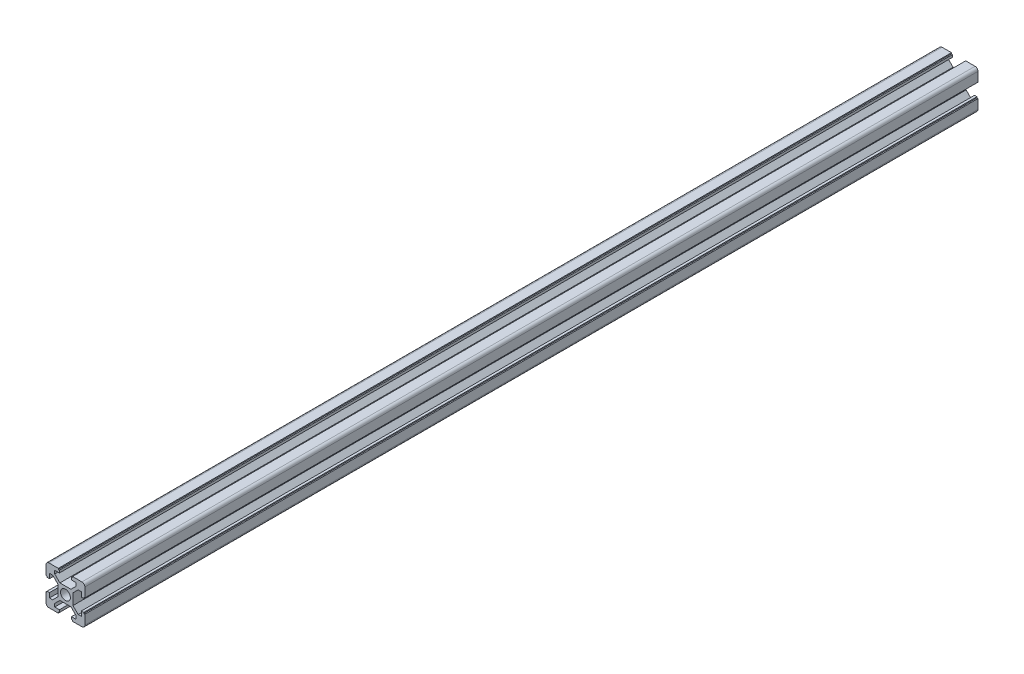
from build123d import *

# Parameters (mm, degrees)
BOSS_EXTRUDE1_DEPTH = 460
SKETCH3_R           = 2.55
CUT_EXTRUDE1_DEPTH  = 461.21733996
FILLET1_R           = 1.5


with BuildPart() as part:
    # Sketch2 → Boss-Extrude1 (new body)
    with BuildSketch(Plane.XY):
        Polygon((-10, 10), (-3.65, 10), (-3.65, 9.45), (-3.1, 9.45), (-3.1, 8.2), (-5.5, 8.2), (-5.5, 6.560660172), (-2.839339828, 3.9), (0, 3.9), (2.839339828, 3.9), (5.5, 6.560660172), (5.5, 8.2), (3.1, 8.2), (3.1, 9.45), (3.65, 9.45), (3.65, 10), (10, 10), (10, 3.65), (9.45, 3.65), (9.45, 3.1), (8.2, 3.1), (8.2, 5.5), (6.560660172, 5.5), (3.9, 2.839339828), (3.9, 0), (3.9, -2.839339828), (6.560660172, -5.5), (8.2, -5.5), (8.2, -3.1), (9.45, -3.1), (9.45, -3.65), (10, -3.65), (10, -10), (3.65, -10), (3.65, -9.45), (3.1, -9.45), (3.1, -8.2), (5.5, -8.2), (5.5, -6.560660172), (2.839339828, -3.9), (0, -3.9), (-2.839339828, -3.9), (-5.5, -6.560660172), (-5.5, -8.2), (-3.1, -8.2), (-3.1, -9.45), (-3.65, -9.45), (-3.65, -10), (-10, -10), (-10, -3.65), (-9.45, -3.65), (-9.45, -3.1), (-8.2, -3.1), (-8.2, -5.5), (-6.560660172, -5.5), (-3.9, -2.839339828), (-3.9, 0), (-3.9, 2.839339828), (-6.560660172, 5.5), (-8.2, 5.5), (-8.2, 3.1), (-9.45, 3.1), (-9.45, 3.65), (-10, 3.65), align=None)
    extrude(amount=-BOSS_EXTRUDE1_DEPTH)

    # Sketch3 → Cut-Extrude1 (cut, through all)
    with BuildSketch(Plane.XY):
        Circle(SKETCH3_R)
    extrude(amount=-CUT_EXTRUDE1_DEPTH, mode=Mode.SUBTRACT)

    # Fillet1
    fillet1_edges = [part.edges().sort_by_distance(p)[0] for p in [
        (10, 10, -230),
        (10, -10, -230),
        (-10, -10, -230),
        (-10, 10, -230),
    ]]
    fillet(fillet1_edges, radius=FILLET1_R)


solid = part.part
